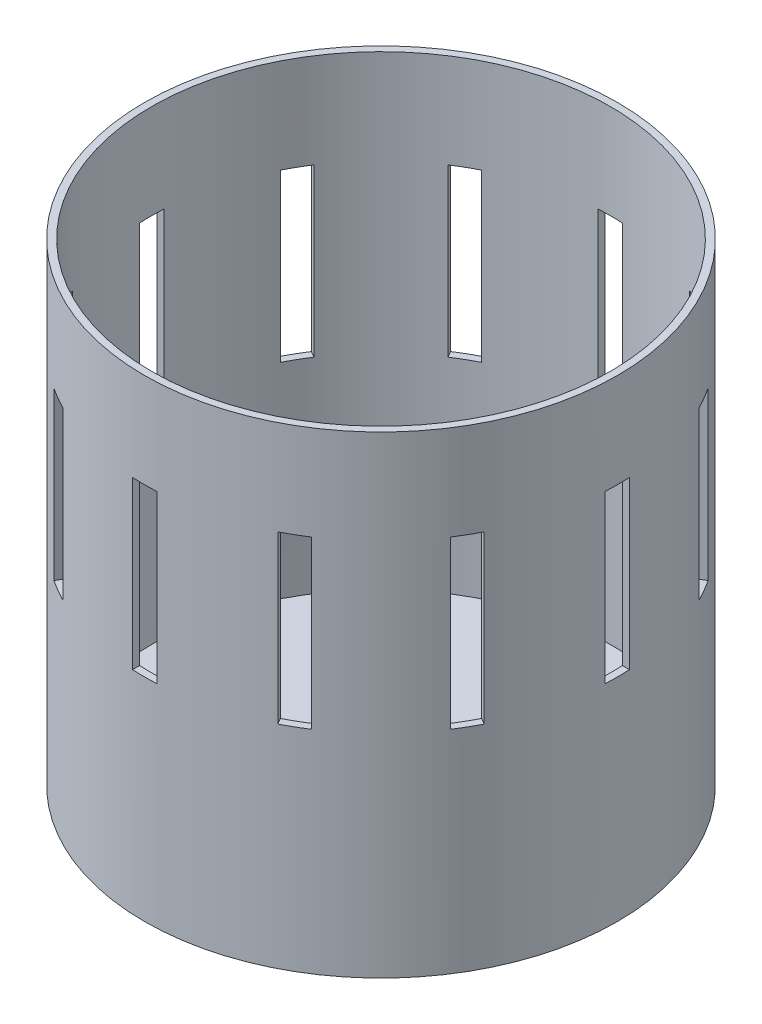
from build123d import *

# Parameters (mm, degrees)
CROQUIS3_R            = 48.5
CORTAR_EXTRUIR1_DEPTH = 98.5
CROQUIS4_R            = 1.1
CORTAR_EXTRUIR2_DEPTH = 98.5
CROQUIS6_W            = 5.2
CROQUIS6_H            = 35.2
CORTAR_EXTRUIR3_DEPTH = 98.5
MATRIZC1_COUNT        = 12


with BuildPart() as part:
    # Croquis2 → Revolución2 (revolve)
    with BuildSketch(Plane.XY, mode=Mode.PRIVATE) as revoluci_n2_sk:
        Polygon((0, 0), (-10, 0), (-10, 5), (-50, 5), (-50, 105), (0, 105), align=None)
    revolve(revoluci_n2_sk.sketch.rotate(Axis((0, 0, 0), (0, 1, 0)), 270), axis=Axis((0, 0, 0), (0, 1, 0)))

    # Croquis3 → Cortar-Extruir1 (cut)
    with BuildSketch(Plane(origin=(0, 105, 0), x_dir=(1, 0, 0), z_dir=(0, 1, 0))):
        with Locations(Location((0, 0, 0), (0, 0, 270))):
            Circle(CROQUIS3_R)
    extrude(amount=-CORTAR_EXTRUIR1_DEPTH, mode=Mode.SUBTRACT)

    # Croquis4 → Cortar-Extruir2 (cut)
    with BuildSketch(Plane.XZ):
        with Locations(Location((0, 0, 0), (0, 0, 270))):
            Circle(CROQUIS4_R)
    extrude(amount=-CORTAR_EXTRUIR2_DEPTH, mode=Mode.SUBTRACT)

    # Croquis6 → Cortar-Extruir3 (cut)
    with BuildSketch(Plane.XY):
        with Locations((0, 67.4)):
            Rectangle(CROQUIS6_W, CROQUIS6_H)
    cortar_extruir3 = extrude(amount=-CORTAR_EXTRUIR3_DEPTH, mode=Mode.SUBTRACT)

    # MatrizC1: Cortar-Extruir3 ×12 about axis
    matrizc1_axis = Axis((0, 0, 0), (0, 1, 0))
    for i in range(1, MATRIZC1_COUNT):
        add(cortar_extruir3.rotate(matrizc1_axis, i * 360 / MATRIZC1_COUNT), mode=Mode.SUBTRACT)


solid = part.part
